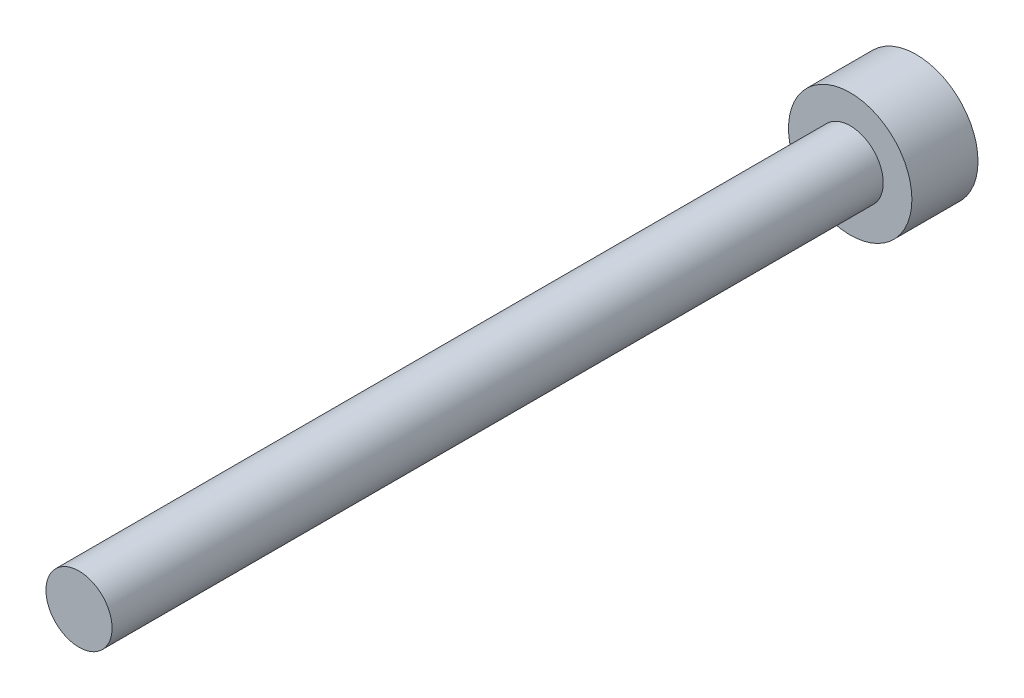
from build123d import *

# Parameters (mm, degrees)
SKETCH_1_R      = 2.8
EXTRUDE_1_DEPTH = 3
SKETCH_2_R      = 1.5
EXTRUDE_2_DEPTH = 35


with BuildPart() as part:
    # 草图1 → 凸台-拉伸1 (new body)
    with BuildSketch(Plane.XY):
        Circle(SKETCH_1_R)
    extrude(amount=EXTRUDE_1_DEPTH)

    # 草图2 → 凸台-拉伸2 (add)
    with BuildSketch(Plane.XY.offset(3)):
        Circle(SKETCH_2_R)
    extrude(amount=EXTRUDE_2_DEPTH)


solid = part.part
